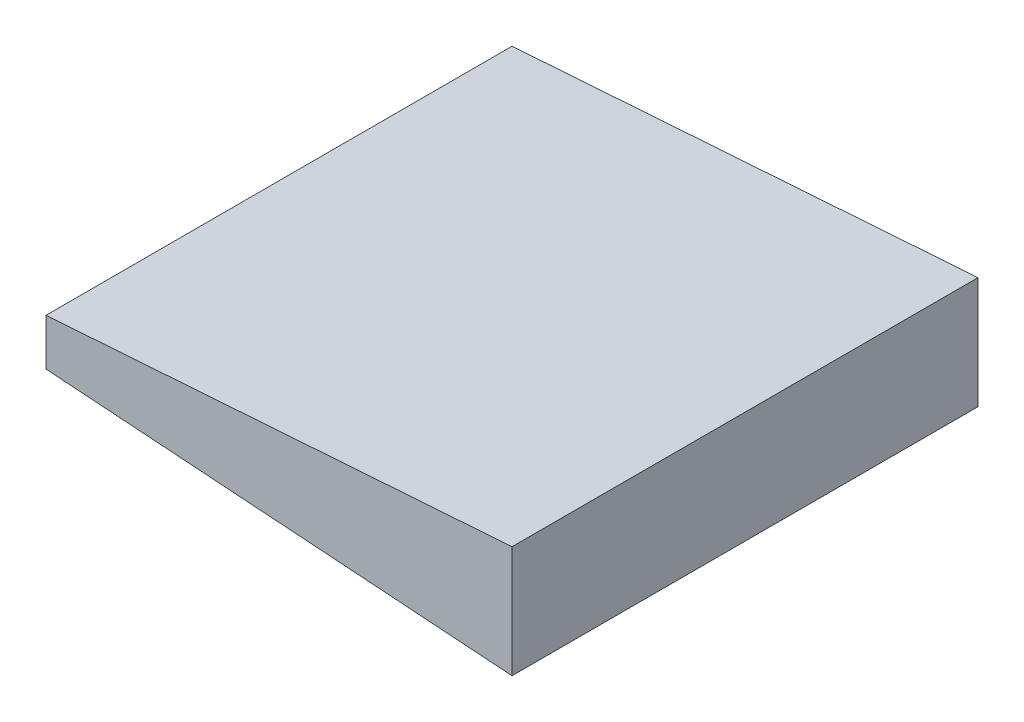
from build123d import *

# Parameters (mm, degrees)
BOSS_EXTRUDE1_DEPTH = 50


with BuildPart() as part:
    # Sketch1 → Boss-Extrude1 (new, symmetric)
    with BuildSketch(Plane.XY):
        Polygon((-50, 5), (-50, -5), (50, -11.992681194), (50, 11.992681194), align=None)
    extrude(amount=BOSS_EXTRUDE1_DEPTH, both=True)


solid = part.part
